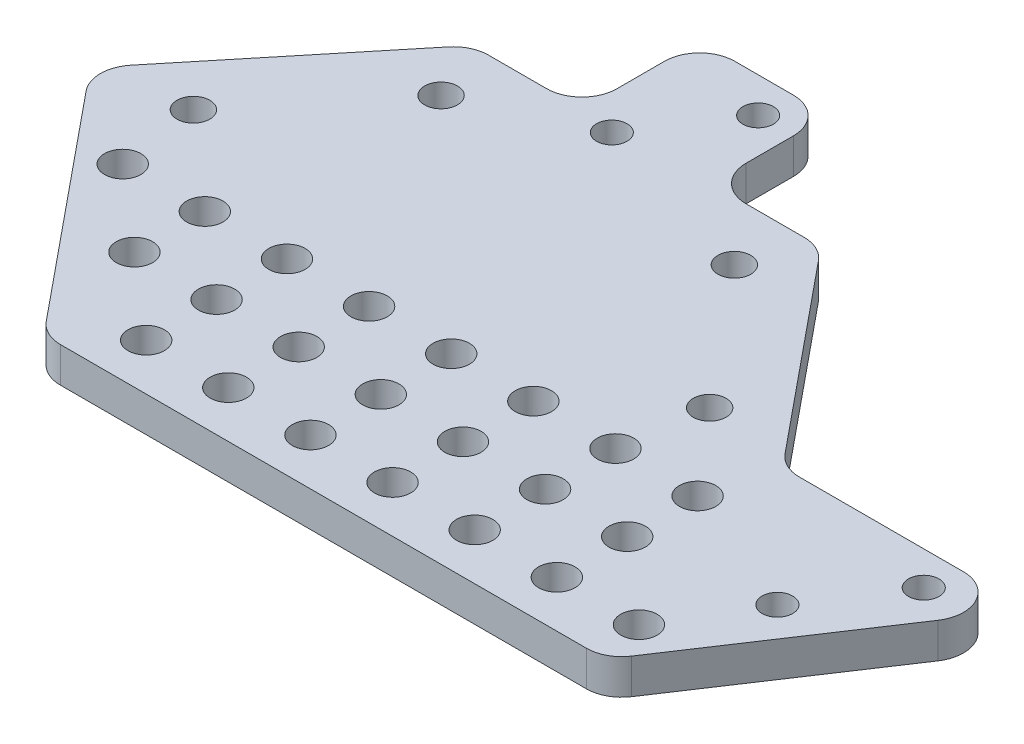
from build123d import *

# Parameters (mm, degrees)
SKETCH_1_R      = 1.55
SKETCH_1_R_2    = 1.4
SKETCH_1_R_3    = 1.3
EXTRUDE_1_DEPTH = 3
FILLET_6_R      = 3
FILLET_7_R      = 3


with BuildPart() as part:
    # 草图1 → 凸台-拉伸1 (new body)
    with BuildSketch(Plane(origin=(0, 0, 0), x_dir=(1, 0, 0), z_dir=(0, 1, 0))):
        Polygon((5.5, 26.649748742), (-5.5, 26.649748742), (-5.5, 16.608186766), (-14.869017707, 16.608186766), (-29.51289706, -1.285380235), (-11.741914225, -23), (36.109047815, -23), (50.51289706, -1.285380235), (31.937783614, -1.285380235), (29.51289706, -1.285380235), (14.869017707, 16.608186766), (5.5, 16.608186766), align=None)
        with Locations(Location((0, -19.02478316, 0), (0, 0, 270))):
            Circle(SKETCH_1_R, mode=Mode.SUBTRACT)
        with Locations(Location((7, -19.02478316, 0), (0, 0, 270))):
            Circle(SKETCH_1_R, mode=Mode.SUBTRACT)
        with Locations(Location((14, -19.02478316, 0), (0, 0, 270))):
            Circle(SKETCH_1_R, mode=Mode.SUBTRACT)
        with Locations(Location((21, -19.02478316, 0), (0, 0, 270))):
            Circle(SKETCH_1_R, mode=Mode.SUBTRACT)
        with Locations(Location((28, -19.02478316, 0), (0, 0, 270))):
            Circle(SKETCH_1_R, mode=Mode.SUBTRACT)
        with Locations(Location((35, -19.02478316, 0), (0, 0, 270))):
            Circle(SKETCH_1_R, mode=Mode.SUBTRACT)
        with Locations(Location((-7, -19.02478316, 0), (0, 0, 270))):
            Circle(SKETCH_1_R, mode=Mode.SUBTRACT)
        with Locations(Location((-14, -13.02478316, 0), (0, 0, 270))):
            Circle(SKETCH_1_R, mode=Mode.SUBTRACT)
        with BuildLine():
            ThreePointArc((-8.55, -13.02478316), (-7, -11.47478316), (-5.45, -13.02478316))
            ThreePointArc((-5.45, -13.02478316), (-7, -14.57478316), (-8.55, -13.02478316))
        make_face(mode=Mode.SUBTRACT)
        with Locations(Location((0, -13.02478316, 0), (0, 0, 270))):
            Circle(SKETCH_1_R, mode=Mode.SUBTRACT)
        with Locations(Location((7, -13.02478316, 0), (0, 0, 270))):
            Circle(SKETCH_1_R, mode=Mode.SUBTRACT)
        with Locations(Location((-21, -7.02478316, 0), (0, 0, 270))):
            Circle(SKETCH_1_R, mode=Mode.SUBTRACT)
        with Locations(Location((-14, -7.02478316, 0), (0, 0, 270))):
            Circle(SKETCH_1_R, mode=Mode.SUBTRACT)
        with Locations(Location((-7, -7.02478316, 0), (0, 0, 270))):
            Circle(SKETCH_1_R, mode=Mode.SUBTRACT)
        with Locations(Location((-22, 0, 0), (0, 0, 270))):
            Circle(SKETCH_1_R_2, mode=Mode.SUBTRACT)
        with Locations(Location((0, -7.02478316, 0), (0, 0, 270))):
            Circle(SKETCH_1_R, mode=Mode.SUBTRACT)
        with Locations(Location((7, -7.02478316, 0), (0, 0, 270))):
            Circle(SKETCH_1_R, mode=Mode.SUBTRACT)
        with Locations(Location((14, -13.02478316, 0), (0, 0, 270))):
            Circle(SKETCH_1_R, mode=Mode.SUBTRACT)
        with Locations(Location((21, -13.02478316, 0), (0, 0, 270))):
            Circle(SKETCH_1_R, mode=Mode.SUBTRACT)
        with Locations(Location((28, -13.02478316, 0), (0, 0, 270))):
            Circle(SKETCH_1_R, mode=Mode.SUBTRACT)
        with Locations(Location((39.429198074, -11.654622417, 0), (0, 0, 270))):
            Circle(SKETCH_1_R_3, mode=Mode.SUBTRACT)
        with Locations(Location((14, -7.02478316, 0), (0, 0, 270))):
            Circle(SKETCH_1_R, mode=Mode.SUBTRACT)
        with Locations(Location((21, -7.02478316, 0), (0, 0, 270))):
            Circle(SKETCH_1_R, mode=Mode.SUBTRACT)
        with Locations(Location((28, -7.02478316, 0), (0, 0, 270))):
            Circle(SKETCH_1_R, mode=Mode.SUBTRACT)
        with Locations(Location((22, 0, 0), (0, 0, 270))):
            Circle(SKETCH_1_R_2, mode=Mode.SUBTRACT)
        with Locations(Location((44.404135259, -4.154622417, 0), (0, 0, 270))):
            Circle(SKETCH_1_R_3, mode=Mode.SUBTRACT)
        with Locations(Location((-12.5, 11.608186766, 0), (0, 0, 270))):
            Circle(SKETCH_1_R_2, mode=Mode.SUBTRACT)
        with Locations(Location((-2.487468593, 16.149748742, 0), (0, 0, 270))):
            Circle(SKETCH_1_R_3, mode=Mode.SUBTRACT)
        with Locations(Location((2.487468593, 23.649748742, 0), (0, 0, 270))):
            Circle(SKETCH_1_R_3, mode=Mode.SUBTRACT)
        with Locations(Location((12.5, 11.608186766, 0), (0, 0, 270))):
            Circle(SKETCH_1_R_2, mode=Mode.SUBTRACT)
    extrude(amount=EXTRUDE_1_DEPTH)

    # 圆角6
    fillet_6_edges = [part.edges().sort_by_distance(p)[0] for p in [
        (-5.5, 1.5, -16.608186766),
        (5.5, 1.5, -16.608186766),
    ]]
    fillet(fillet_6_edges, radius=FILLET_6_R)

    # 圆角7
    fillet_7_edges = [part.edges().sort_by_distance(p)[0] for p in [
        (14.869017707, 1.5, -16.608186766),
        (29.51289706, 1.5, 1.285380235),
        (50.51289706, 1.5, 1.285380235),
        (36.109047815, 1.5, 23),
        (-11.741914225, 1.5, 23),
        (-29.51289706, 1.5, 1.285380235),
        (-14.869017707, 1.5, -16.608186766),
        (-5.5, 1.5, -26.649748742),
        (5.5, 1.5, -26.649748742),
    ]]
    fillet(fillet_7_edges, radius=FILLET_7_R)


solid = part.part
